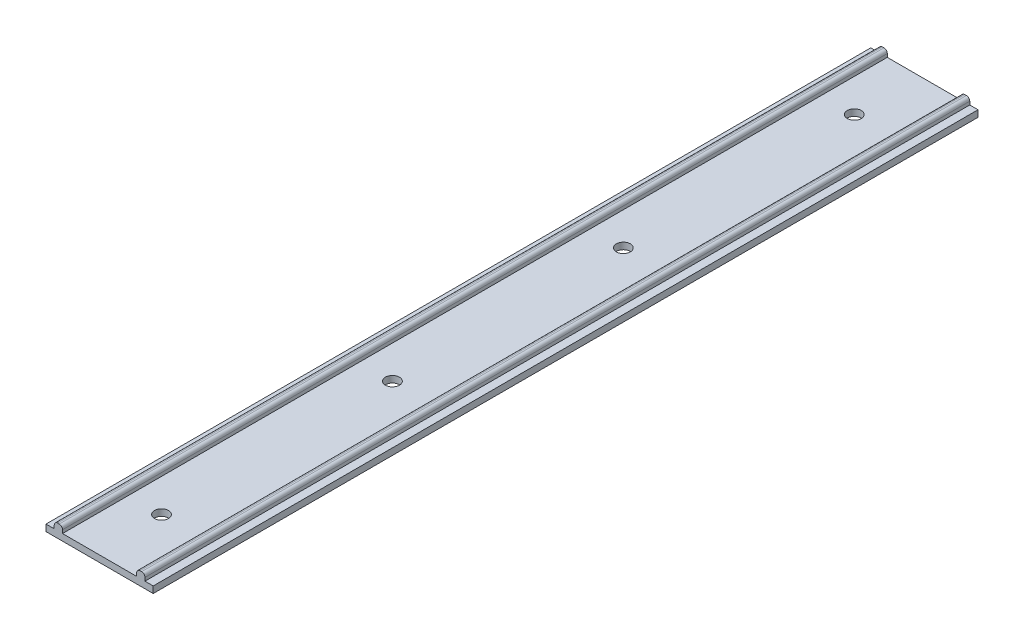
from build123d import *

# Parameters (mm, degrees)
Y_KSEKLIK_EKSTR_ZYON1_DEPTH = 500
RADYUS1_R                   = 2
IZIM2_R                     = 4.25
KES_EKSTR_ZYON1_DEPTH       = 10


with BuildPart() as part:
    # Çizim1 → Yükseklik-Ekstrüzyon1 (new body)
    with BuildSketch(Plane.XY):
        Polygon((0, 0), (65, 0), (65, 4), (60, 4), (60, 8), (55, 8), (55, 4), (10, 4), (10, 8), (5, 8), (5, 4), (0, 4), align=None)
    extrude(amount=-Y_KSEKLIK_EKSTR_ZYON1_DEPTH)

    # Radyus1
    radyus1_edges = [part.edges().sort_by_distance(p)[0] for p in [
        (5, 8, -250),
        (10, 8, -250),
        (55, 8, -250),
        (60, 8, -250),
    ]]
    fillet(radyus1_edges, radius=RADYUS1_R)

    # Çizim2 → Kes-Ekstrüzyon1 (cut)
    with BuildSketch(Plane.XZ):
        with Locations(Location((30, -40, 0), (0, 0, 270))):
            Circle(IZIM2_R)
        with Locations(Location((30, -180, 0), (0, 0, 270))):
            Circle(IZIM2_R)
        with Locations(Location((30, -320, 0), (0, 0, 270))):
            Circle(IZIM2_R)
        with Locations(Location((30, -460, 0), (0, 0, 270))):
            Circle(IZIM2_R)
    extrude(amount=-KES_EKSTR_ZYON1_DEPTH, mode=Mode.SUBTRACT)


solid = part.part
